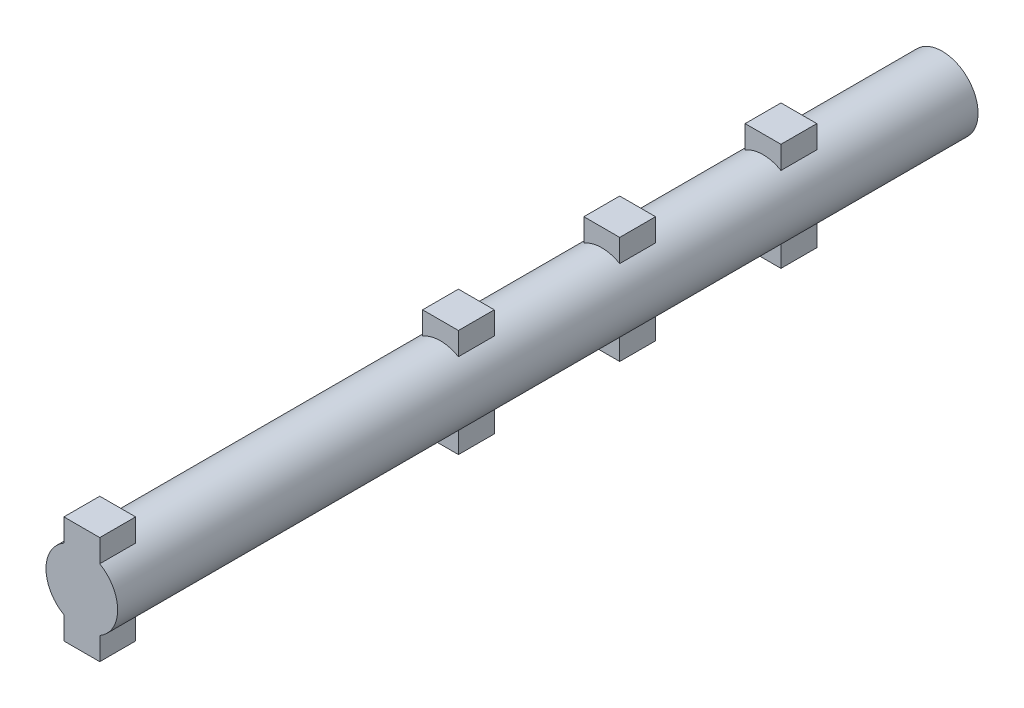
from build123d import *

# Parameters (mm, degrees)
SKETCH1_R             = 5
BOSS_EXTRUDE1_DEPTH   = 25
SKETCH2_W             = 5
SKETCH2_H             = 15
BOSS_EXTRUDE2_DEPTH   = 5
SKETCH3_W             = 5
SKETCH3_H             = 15
BOSS_EXTRUDE3_DEPTH   = 2.5
SKETCH5_W             = 5
SKETCH5_H             = 15
BOSS_EXTRUDE5_DEPTH   = 2.5
BOSS_EXTRUDE6_START   = 25
SKETCH6_R             = 5
BOSS_EXTRUDE6_DEPTH   = 25
SKETCH7_W             = 5
SKETCH7_H             = 15
BOSS_EXTRUDE7_DEPTH   = 5
F_5_0MM_DOWEL_HOLE1_D = 5
BOSS_EXTRUDE8_START   = 20
SKETCH14_R            = 5
BOSS_EXTRUDE8_DEPTH   = 20
SKETCH15_R            = 5
BOSS_EXTRUDE9_DEPTH   = 50.04395072
SKETCH18_W            = 5
SKETCH18_H            = 15
BOSS_EXTRUDE10_DEPTH  = 5


with BuildPart() as part:
    # Sketch1 → Boss-Extrude1 (new body)
    with BuildSketch(Plane.XY):
        with Locations(Location((0, 0, 0), (0, 0, 180))):
            Circle(SKETCH1_R)
    extrude(amount=BOSS_EXTRUDE1_DEPTH)

    # Sketch2 → Boss-Extrude2 (add)
    with BuildSketch(Plane.XY.offset(25)):
        Rectangle(SKETCH2_W, SKETCH2_H)
    extrude(amount=-BOSS_EXTRUDE2_DEPTH)

    # Sketch3 → Boss-Extrude3 (add)
    with BuildSketch(Plane(origin=(0, 0, 0), x_dir=(-1, 0, 0), z_dir=(0, 0, -1))):
        Rectangle(SKETCH3_W, SKETCH3_H)
    extrude(amount=-BOSS_EXTRUDE3_DEPTH)

    # Sketch5 → Boss-Extrude5 (add)
    with BuildSketch(Plane(origin=(0, 0, 0), x_dir=(-1, 0, 0), z_dir=(0, 0, -1))):
        Rectangle(SKETCH5_W, SKETCH5_H)
    extrude(amount=BOSS_EXTRUDE5_DEPTH)

    # Sketch6 → Boss-Extrude6 (add)
    with BuildSketch(Plane(origin=(0, 0, 0), x_dir=(-1, 0, 0), z_dir=(0, 0, -1)).offset(BOSS_EXTRUDE6_START)):
        Circle(SKETCH6_R)
    extrude(amount=-BOSS_EXTRUDE6_DEPTH)

    # Sketch7 → Boss-Extrude7 (add)
    with BuildSketch(Plane(origin=(0, 0, -25), x_dir=(-1, 0, 0), z_dir=(0, 0, -1))):
        Rectangle(SKETCH7_W, SKETCH7_H)
    extrude(amount=-BOSS_EXTRUDE7_DEPTH)

    # Ø5.0mm Dowel Hole1 (through all)
    with Locations(Plane.XY.offset(25)):
        with Locations((0, 0)):
            Hole(F_5_0MM_DOWEL_HOLE1_D / 2)

    # Sketch14 → Boss-Extrude8 (add)
    with BuildSketch(Plane(origin=(0, 0, -25), x_dir=(-1, 0, 0), z_dir=(0, 0, -1)).offset(BOSS_EXTRUDE8_START)):
        Circle(SKETCH14_R)
    extrude(amount=-BOSS_EXTRUDE8_DEPTH)

    # Sketch15 → Boss-Extrude9 (add)
    with BuildSketch(Plane.XY.offset(25)):
        with Locations(Location((0, 0, 0), (0, 0, 180))):
            Circle(SKETCH15_R)
    extrude(amount=BOSS_EXTRUDE9_DEPTH)

    # Sketch18 → Boss-Extrude10 (add)
    with BuildSketch(Plane.XY.offset(75.04395072)):
        Rectangle(SKETCH18_W, SKETCH18_H)
    extrude(amount=-BOSS_EXTRUDE10_DEPTH)


solid = part.part
